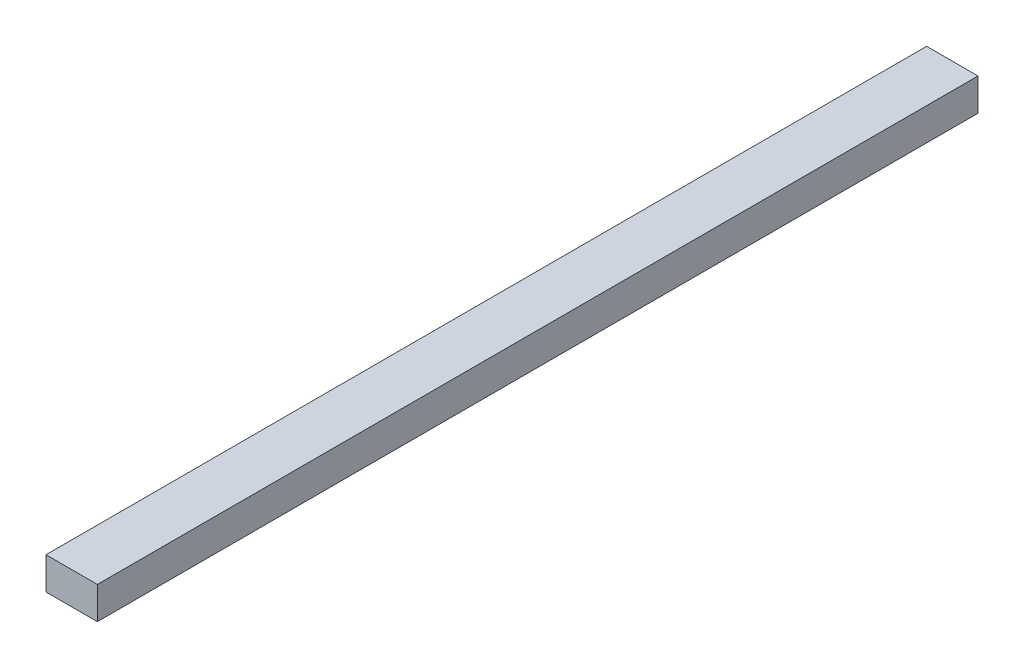
from build123d import *

# Parameters (mm, degrees)
BOSS_EXTRUDE1_DEPTH      = 600
BOSS_EXTRUDE1_DEPTH_BACK = 600
SKETCH1_W                = 70
SKETCH1_H                = 44


with BuildPart() as part:
    # Sketch1 → Boss-Extrude1 (new, two sides: drawn at the far end of the back side and taken through both)
    with BuildSketch(Plane.XY.offset(-BOSS_EXTRUDE1_DEPTH_BACK)):
        Rectangle(SKETCH1_W, SKETCH1_H)
    extrude(amount=BOSS_EXTRUDE1_DEPTH + BOSS_EXTRUDE1_DEPTH_BACK)


solid = part.part
